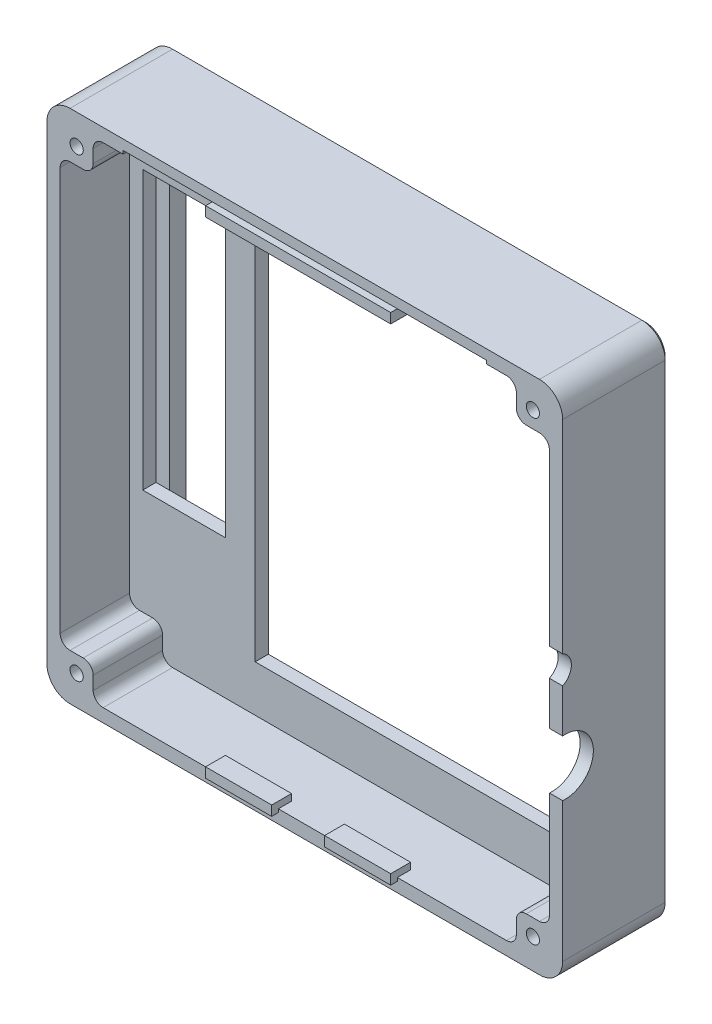
from build123d import *

# Parameters (mm, degrees)
SKETCH_1_W           = 78
SKETCH_1_H           = 78
EXTRUDE_1_DEPTH      = 5.5
SKETCH_2_W           = 78
SKETCH_2_H           = 78
SKETCH_2_W_2         = 74
SKETCH_2_H_2         = 74
SKETCH_2_W_3         = 5
SKETCH_2_H_3         = 5
EXTRUDE_2_DEPTH      = 10.5
FILLET_1_R           = 1.5
FILLET_2_R           = 3.5
CUT_EXTRUDE_1_DEPTH  = 1
CUT_EXTRUDE_2_DEPTH  = 2.5
SKETCH_5_R           = 1
CUT_EXTRUDE_3_DEPTH  = 58.15767665
CHAMFER_1_SIZE       = 0.5
SKETCH_6_W           = 55
SKETCH_6_H           = 2
SKETCH_6_W_2         = 54
SKETCH_6_H_2         = 58
SKETCH_6_W_3         = 12.5
SKETCH_6_H_3         = 42
CUT_EXTRUDE_4_DEPTH  = 57.553072419
EXTRUDE_3_DEPTH      = 1
EXTRUDE_3_DEPTH_BACK = 2
SKETCH_7_W           = 10
SKETCH_7_H           = 1.5
SKETCH_7_W_2         = 28
SKETCH_8_R           = 4.25
SKETCH_8_R_2         = 2.32594067
CUT_EXTRUDE_5_DEPTH  = 10


with BuildPart() as part:
    # 草图1 → 凸台-拉伸1 (new body)
    with BuildSketch(Plane.XY):
        Rectangle(SKETCH_1_W, SKETCH_1_H)
    extrude(amount=EXTRUDE_1_DEPTH)

    # 草图2 → 凸台-拉伸2 (add)
    # profile 1 of 5: a face of its own
    with BuildSketch(Plane.XY.offset(5.5)):
        Rectangle(SKETCH_2_W, SKETCH_2_H)
        Rectangle(SKETCH_2_W_2, SKETCH_2_H_2, mode=Mode.SUBTRACT)
    # profile 2 of 5: a face of its own
    with BuildSketch(Plane.XY.offset(5.5)):
        with Locations((-34.5, 34.5)):
            Rectangle(SKETCH_2_W_3, SKETCH_2_H_3)
    # profile 3 of 5: a face of its own
    with BuildSketch(Plane.XY.offset(5.5)):
        with Locations((34.5, 34.5)):
            Rectangle(SKETCH_2_W_3, SKETCH_2_H_3)
    # profile 4 of 5: a face of its own
    with BuildSketch(Plane.XY.offset(5.5)):
        with Locations((34.5, -34.5)):
            Rectangle(SKETCH_2_W_3, SKETCH_2_H_3)
    # profile 5 of 5: a face of its own
    with BuildSketch(Plane.XY.offset(5.5)):
        with Locations((-34.5, -34.5)):
            Rectangle(SKETCH_2_W_3, SKETCH_2_H_3)
    extrude(amount=EXTRUDE_2_DEPTH)

    # 圆角1
    fillet_1_edges = [part.edges().sort_by_distance(p)[0] for p in [
        (-37, -32, 10.75),
        (-37, 32, 10.75),
        (-32, 32, 10.75),
        (-32, 37, 10.75),
        (32, 37, 10.75),
        (32, 32, 10.75),
        (37, 32, 10.75),
        (37, -32, 10.75),
        (32, -32, 10.75),
        (32, -37, 10.75),
        (-32, -37, 10.75),
        (-32, -32, 10.75),
    ]]
    fillet(fillet_1_edges, radius=FILLET_1_R)

    # 圆角2
    fillet_2_edges = [part.edges().sort_by_distance(p)[0] for p in [
        (39, -39, 8),
        (-39, -39, 8),
        (-39, 39, 8),
        (39, 39, 8),
    ]]
    fillet(fillet_2_edges, radius=FILLET_2_R)

    # 草图3 → 切除-拉伸1 (cut)
    with BuildSketch(Plane(origin=(0, 0, 0), x_dir=(-1, 0, 0), z_dir=(0, 0, -1))):
        with BuildLine():
            Line((37.5, -35.5), (37.5, 35.5))
            ThreePointArc((37.5, 35.5), (36.914213562, 36.914213562), (35.5, 37.5))
            Line((35.5, 37.5), (-35.5, 37.5))
            ThreePointArc((-35.5, 37.5), (-36.914213562, 36.914213562), (-37.5, 35.5))
            Line((-37.5, 35.5), (-37.5, -35.5))
            ThreePointArc((-37.5, -35.5), (-36.914213562, -36.914213562), (-35.5, -37.5))
            Line((-35.5, -37.5), (35.5, -37.5))
            ThreePointArc((35.5, -37.5), (36.914213562, -36.914213562), (37.5, -35.5))
        make_face()
    extrude(amount=-CUT_EXTRUDE_1_DEPTH, mode=Mode.SUBTRACT)

    # 草图4 → 切除-拉伸2 (cut)
    with BuildSketch(Plane(origin=(0, 0, 1), x_dir=(-1, 0, 0), z_dir=(0, 0, -1))):
        Polygon((27.5, 37.5), (-27.5, 37.5), (-27.5, 36.85), (-32.95, 36.85), (-32.95, -33), (32.95, -33), (32.95, 36.85), (27.5, 36.85), align=None)
    extrude(amount=-CUT_EXTRUDE_2_DEPTH, mode=Mode.SUBTRACT)

    # 草图5 → 切除-拉伸3 (cut, through all)
    with BuildSketch(Plane(origin=(0, 0, 1), x_dir=(-1, 0, 0), z_dir=(0, 0, -1))):
        with Locations((-34.5, 34.5)):
            Circle(SKETCH_5_R)
        with Locations((34.5, 34.5)):
            Circle(SKETCH_5_R)
        with Locations((34.5, -34.5)):
            Circle(SKETCH_5_R)
        with Locations((-34.5, -34.5)):
            Circle(SKETCH_5_R)
    extrude(amount=-CUT_EXTRUDE_3_DEPTH, mode=Mode.SUBTRACT)

    # 倒角1
    chamfer_1_edges = [part.edges().sort_by_distance(p)[0] for p in [
        (-39, 0, 0),
        (39, 0, 0),
        (0, -39, 0),
        (0, 39, 0),
        (-37.974873734, -37.974873734, 0),
        (37.974873734, -37.974873734, 0),
        (37.974873734, 37.974873734, 0),
        (-37.974873734, 37.974873734, 0),
    ]]
    chamfer(chamfer_1_edges, length=CHAMFER_1_SIZE)

    # 草图6 → 切除-拉伸4 (cut, through all)
    with BuildSketch(Plane(origin=(0, 0, 3.5), x_dir=(-1, 0, 0), z_dir=(0, 0, -1))):
        with Locations((0, 36.5)):
            Rectangle(SKETCH_6_W, SKETCH_6_H)
        with Locations((-9, -1)):
            Rectangle(SKETCH_6_W_2, SKETCH_6_H_2)
        with Locations((28.75, 5)):
            Rectangle(SKETCH_6_W_3, SKETCH_6_H_3)
    extrude(amount=-CUT_EXTRUDE_4_DEPTH, mode=Mode.SUBTRACT)

    # 草图7 → 凸台-拉伸3 (add, two sides: drawn at the far end of the back side and taken through both)
    with BuildSketch(Plane.XY.offset(16).offset(-EXTRUDE_3_DEPTH_BACK)):
        with Locations((9, -36.75)):
            Rectangle(SKETCH_7_W, SKETCH_7_H)
        with Locations((-9, -36.75)):
            Rectangle(SKETCH_7_W, SKETCH_7_H)
        with Locations((0, 36.75)):
            Rectangle(SKETCH_7_W_2, SKETCH_7_H)
    extrude(amount=EXTRUDE_3_DEPTH + EXTRUDE_3_DEPTH_BACK)

    # 草图8 → 切除-拉伸5 (cut)
    with BuildSketch(Plane(origin=(39, 0, 0), x_dir=(0, 0, -1), z_dir=(1, 0, 0))):
        with Locations((-15.6, -10.2)):
            Circle(SKETCH_8_R)
        with Locations((-17, 2.7)):
            Circle(SKETCH_8_R_2)
    extrude(amount=-CUT_EXTRUDE_5_DEPTH, mode=Mode.SUBTRACT)


solid = part.part
